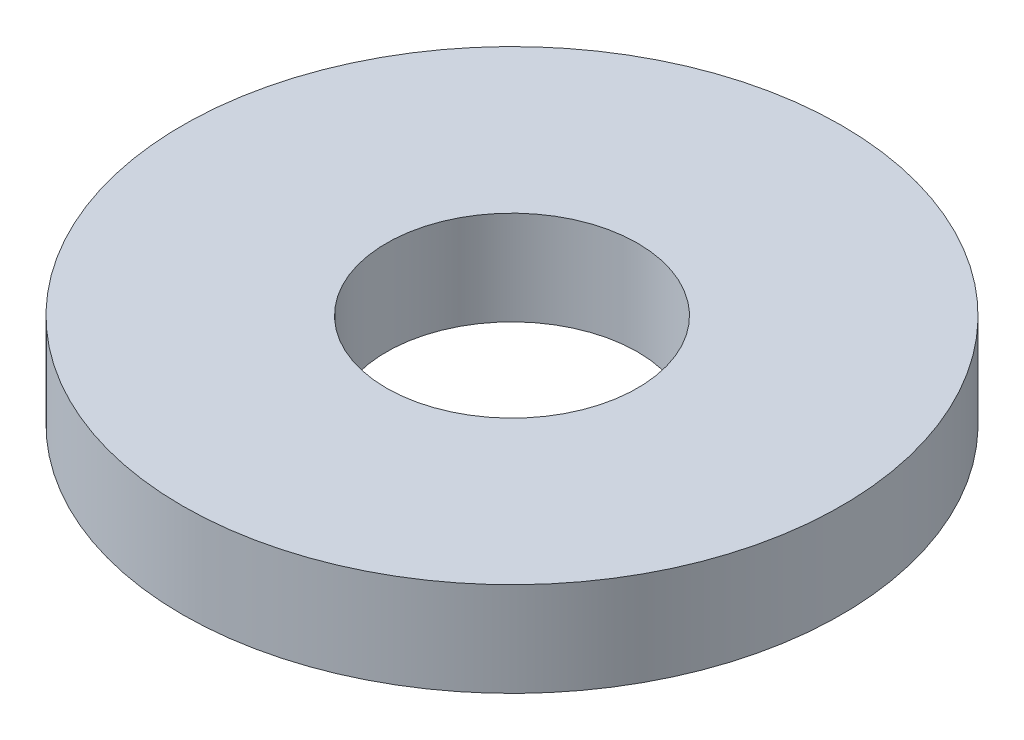
from build123d import *

# Parameters (mm, degrees)
SKETCH1_R           = 10.5
SKETCH1_R_2         = 4
BOSS_EXTRUDE1_DEPTH = 3


with BuildPart() as part:
    # Sketch1 → Boss-Extrude1 (new body)
    with BuildSketch(Plane(origin=(0, 0, 0), x_dir=(1, 0, 0), z_dir=(0, 1, 0))):
        with Locations(Location((0, 0, 0), (0, 0, 270))):
            Circle(SKETCH1_R)
        with Locations(Location((0, 0, 0), (0, 0, 270))):
            Circle(SKETCH1_R_2, mode=Mode.SUBTRACT)
    extrude(amount=BOSS_EXTRUDE1_DEPTH)


solid = part.part
